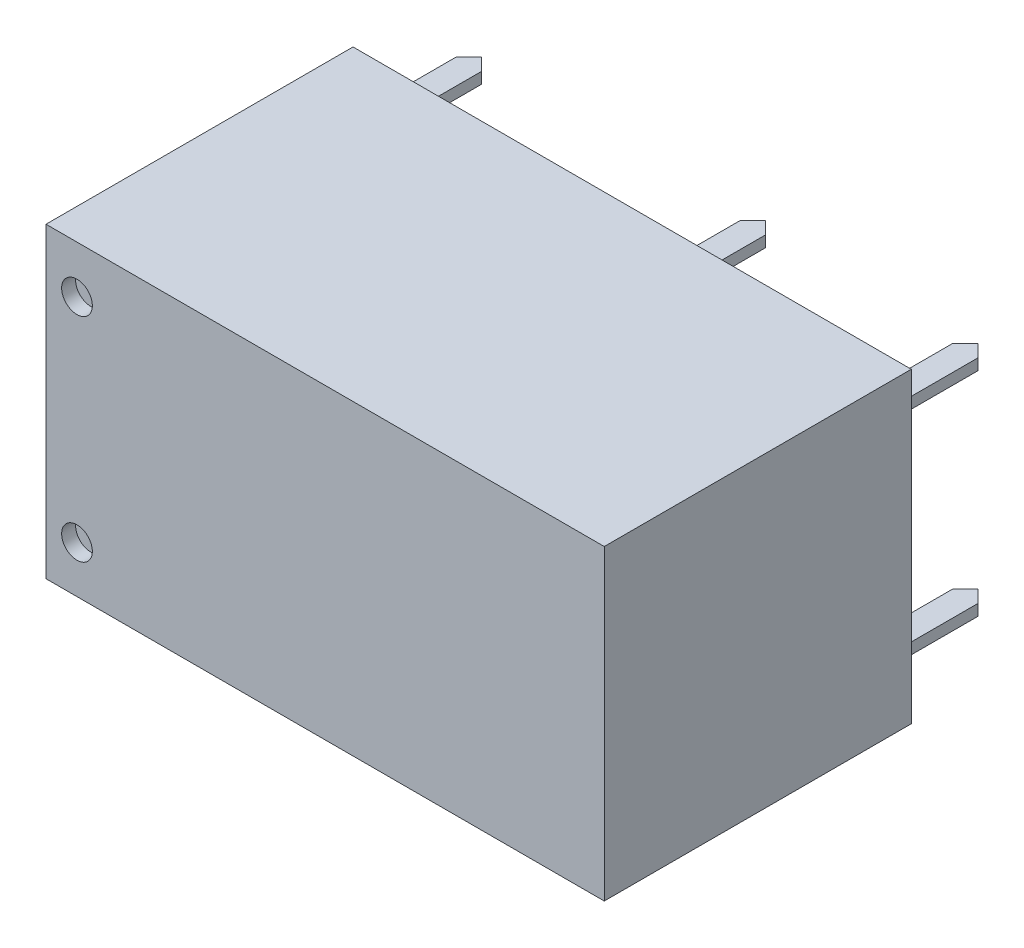
from build123d import *

# Parameters (mm, degrees)
SKIZZE1_W                       = 20
SKIZZE1_H                       = 11
AUFSATZ_LINEAR_AUSTRAGEN1_DEPTH = 11
SKIZZE2_R                       = 0.55
SCHNITT_LINEAR_AUSTRAGEN1_DEPTH = 0.5
AUFSATZ_LINEAR_AUSTRAGEN2_DEPTH = 0.2
LINEARES_MUSTER1_COUNT          = 2
LINEARES_MUSTER1_PITCH          = 10.16
LINEARES_MUSTER2_COUNT          = 2
LINEARES_MUSTER2_PITCH          = 17.78
LINEARES_MUSTER3_COUNT          = 2
LINEARES_MUSTER3_PITCH          = 7.62
LINEARES_MUSTER3_COPY_1_DEPTH   = 0.2
LINEARES_MUSTER3_COPY_2_DEPTH   = 0.2


with BuildPart() as part:
    # Skizze1 → Aufsatz-Linear austragen1 (new body)
    with BuildSketch(Plane.XY):
        with Locations((8.89, -3.8)):
            Rectangle(SKIZZE1_W, SKIZZE1_H)
    extrude(amount=AUFSATZ_LINEAR_AUSTRAGEN1_DEPTH)

    # Skizze2 → Schnitt-Linear austragen1 (cut)
    with BuildSketch(Plane.XY.offset(11)):
        Circle(SKIZZE2_R)
        with Locations((0, -7.62)):
            Circle(SKIZZE2_R)
    extrude(amount=-SCHNITT_LINEAR_AUSTRAGEN1_DEPTH, mode=Mode.SUBTRACT)

    # Skizze3 → Aufsatz-Linear austragen2 (add, symmetric)
    with BuildSketch(Plane(origin=(0, 0, 0), x_dir=(1, 0, 0), z_dir=(0, 1, 0))):
        Polygon((-0.45, 0), (-0.45, 3.05), (0, 3.5), (0.45, 3.05), (0.45, 0), align=None)
    aufsatz_linear_austragen2 = extrude(amount=AUFSATZ_LINEAR_AUSTRAGEN2_DEPTH, both=True)

    # Lineares Muster1: Aufsatz-Linear austragen2 ×2
    with Locations(*[(i * LINEARES_MUSTER1_PITCH, 0, 0) for i in range(1, LINEARES_MUSTER1_COUNT)]):
        add(aufsatz_linear_austragen2)

    # Lineares Muster2: Aufsatz-Linear austragen2 ×2
    with Locations(*[(i * LINEARES_MUSTER2_PITCH, 0, 0) for i in range(1, LINEARES_MUSTER2_COUNT)]):
        add(aufsatz_linear_austragen2)

    # Lineares Muster3: Aufsatz-Linear austragen2 ×2
    with Locations(*[(0, -i * LINEARES_MUSTER3_PITCH, 0) for i in range(1, LINEARES_MUSTER3_COUNT)]):
        add(aufsatz_linear_austragen2)

    # Lineares Muster3 copy 1 sketch → Lineares Muster3 copy 1 (add, symmetric)
    with BuildSketch(Plane(origin=(10.16, -7.62, 0), x_dir=(1, 0, 0), z_dir=(0, 1, 0))):
        Polygon((-0.45, 0), (-0.45, 3.05), (0, 3.5), (0.45, 3.05), (0.45, 0), align=None)
    extrude(amount=LINEARES_MUSTER3_COPY_1_DEPTH, both=True)

    # Lineares Muster3 copy 2 sketch → Lineares Muster3 copy 2 (add, symmetric)
    with BuildSketch(Plane(origin=(17.78, -7.62, 0), x_dir=(1, 0, 0), z_dir=(0, 1, 0))):
        Polygon((-0.45, 0), (-0.45, 3.05), (0, 3.5), (0.45, 3.05), (0.45, 0), align=None)
    extrude(amount=LINEARES_MUSTER3_COPY_2_DEPTH, both=True)


solid = part.part
